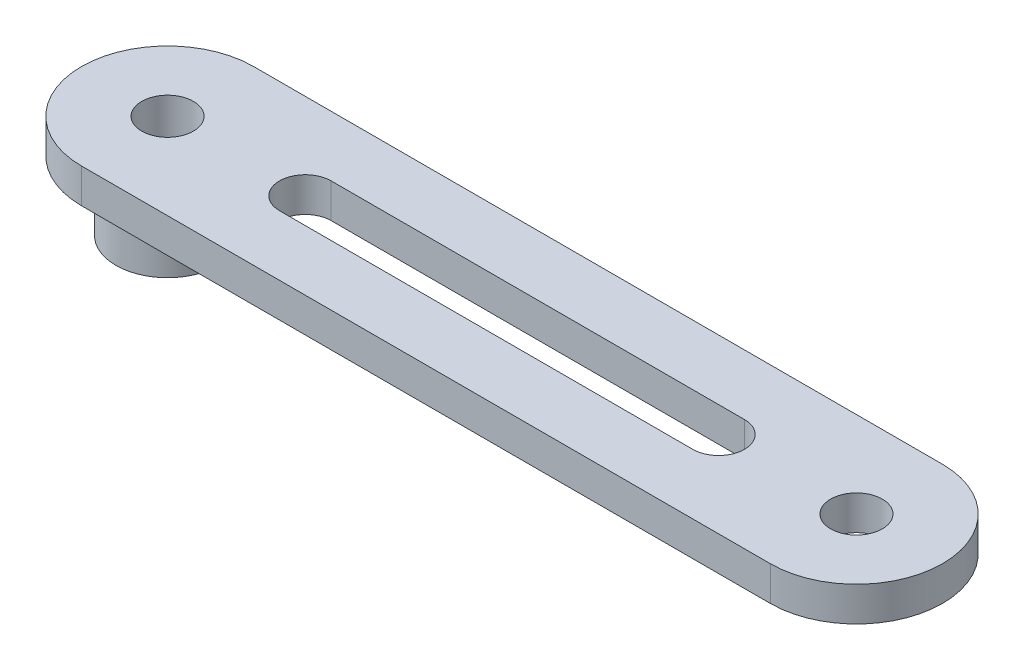
from build123d import *
from build123d.topology import SkipClean

# Parameters (mm, degrees)
SKETCH2_R           = 7.5
BOSS_EXTRUDE1_DEPTH = 10
BOSS_EXTRUDE2_START = 20
SKETCH3_R           = 15
SKETCH3_R_2         = 7.5
BOSS_EXTRUDE2_DEPTH = 20


with BuildPart() as part:
    # Sketch2 → Boss-Extrude1 (new body)
    with BuildSketch(Plane(origin=(0, 0, 0), x_dir=(1, 0, 0), z_dir=(0, 1, 0))):
        with BuildLine():
            Line((-100, 25), (100, 25))
            ThreePointArc((100, 25), (125, 0), (100, -25))
            Line((100, -25), (-100, -25))
            ThreePointArc((-100, -25), (-125, 0), (-100, 25))
        make_face()
        with Locations(Location((100, 0, 0), (0, 0, 270))):
            Circle(SKETCH2_R, mode=Mode.SUBTRACT)
        with Locations(Location((-100, 0, 0), (0, 0, 270))):
            Circle(SKETCH2_R, mode=Mode.SUBTRACT)
        with BuildLine():
            Line((-60, 7.5), (60, 7.5))
            ThreePointArc((60, 7.5), (67.5, 0), (60, -7.5))
            Line((60, -7.5), (-60, -7.5))
            ThreePointArc((-60, -7.5), (-67.5, 0), (-60, 7.5))
        make_face(mode=Mode.SUBTRACT)
    extrude(amount=BOSS_EXTRUDE1_DEPTH)

    # Sketch3 → Boss-Extrude2 (add)
    with SkipClean():  # the faces are left unmerged after this step: merging them gives an invalid solid
        with BuildSketch(Plane.XZ.offset(BOSS_EXTRUDE2_START)):
            with Locations(Location((-100, 0, 0), (0, 0, 90))):
                Circle(SKETCH3_R)
            with Locations(Location((-100, 0, 0), (0, 0, 270))):
                Circle(SKETCH3_R_2, mode=Mode.SUBTRACT)
        extrude(amount=-BOSS_EXTRUDE2_DEPTH)


solid = part.part
